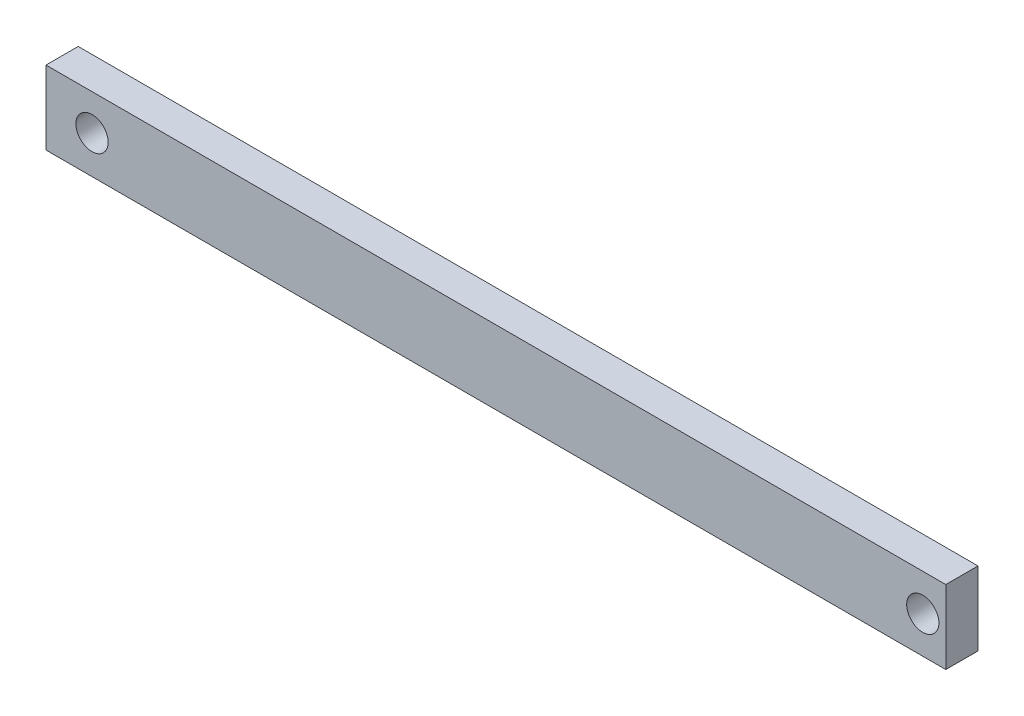
from build123d import *

# Parameters (mm, degrees)
SKETCH1_W           = 391
SKETCH1_H           = 32
BOSS_EXTRUDE1_DEPTH = 14
SKETCH2_R           = 7
CUT_EXTRUDE1_DEPTH  = 240.714328282
SKETCH3_R           = 7
CUT_EXTRUDE2_DEPTH  = 240.714328282


with BuildPart() as part:
    # Sketch1 → Boss-Extrude1 (new body)
    with BuildSketch(Plane.XY):
        with Locations((-42.357142857, 10.285714286)):
            Rectangle(SKETCH1_W, SKETCH1_H)
    extrude(amount=BOSS_EXTRUDE1_DEPTH)

    # Sketch2 → Cut-Extrude1 (cut, through all)
    with BuildSketch(Plane.XY.offset(14)):
        with Locations((-217.857142857, 10.691731498)):
            Circle(SKETCH2_R)
    extrude(amount=-CUT_EXTRUDE1_DEPTH, mode=Mode.SUBTRACT)

    # Sketch3 → Cut-Extrude2 (cut, through all)
    with BuildSketch(Plane.XY.offset(14)):
        with Locations((143.142857143, 10.285714286)):
            Circle(SKETCH3_R)
    extrude(amount=-CUT_EXTRUDE2_DEPTH, mode=Mode.SUBTRACT)


solid = part.part
